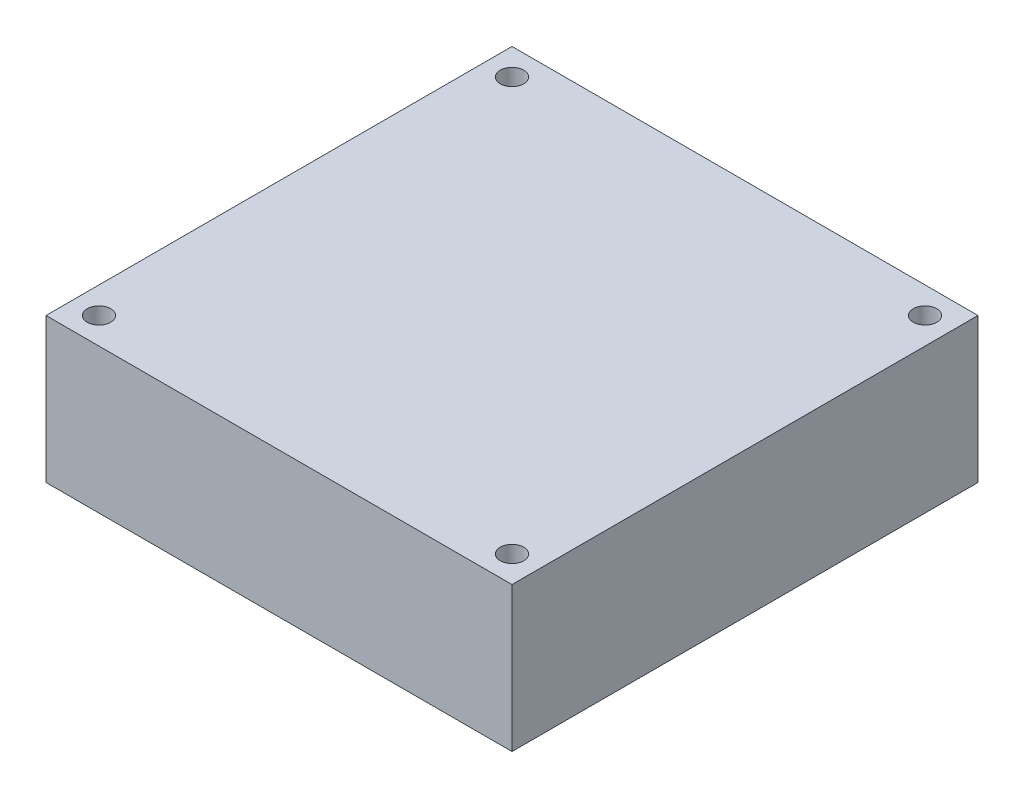
from build123d import *

# Parameters (mm, degrees)
SKETCH1_W           = 80.518
SKETCH1_H           = 80.518
BOSS_EXTRUDE1_DEPTH = 24.9936
SKETCH2_R           = 2.032
CUT_EXTRUDE1_DEPTH  = 117.580344351


with BuildPart() as part:
    # Sketch1 → Boss-Extrude1 (new body)
    with BuildSketch(Plane(origin=(0, 0, 0), x_dir=(1, 0, 0), z_dir=(0, 1, 0))):
        with Locations((40.259, 40.259)):
            Rectangle(SKETCH1_W, SKETCH1_H)
    extrude(amount=BOSS_EXTRUDE1_DEPTH)

    # Sketch2 → Cut-Extrude1 (cut, through all)
    with BuildSketch(Plane(origin=(0, 24.9936, 0), x_dir=(1, 0, 0), z_dir=(0, 1, 0))):
        with Locations(Location((4.572, 75.946, 0), (0, 0, 270))):
            Circle(SKETCH2_R)
        with Locations(Location((75.946, 75.946, 0), (0, 0, 270))):
            Circle(SKETCH2_R)
    cut_extrude1 = extrude(amount=-CUT_EXTRUDE1_DEPTH, mode=Mode.SUBTRACT)

    # Mirror1: Cut-Extrude1 across plane
    add(cut_extrude1.mirror(Plane(origin=(0, 0, -40.259), x_dir=(1, 0, 0), z_dir=(0, 0, -1))), mode=Mode.SUBTRACT)


solid = part.part
